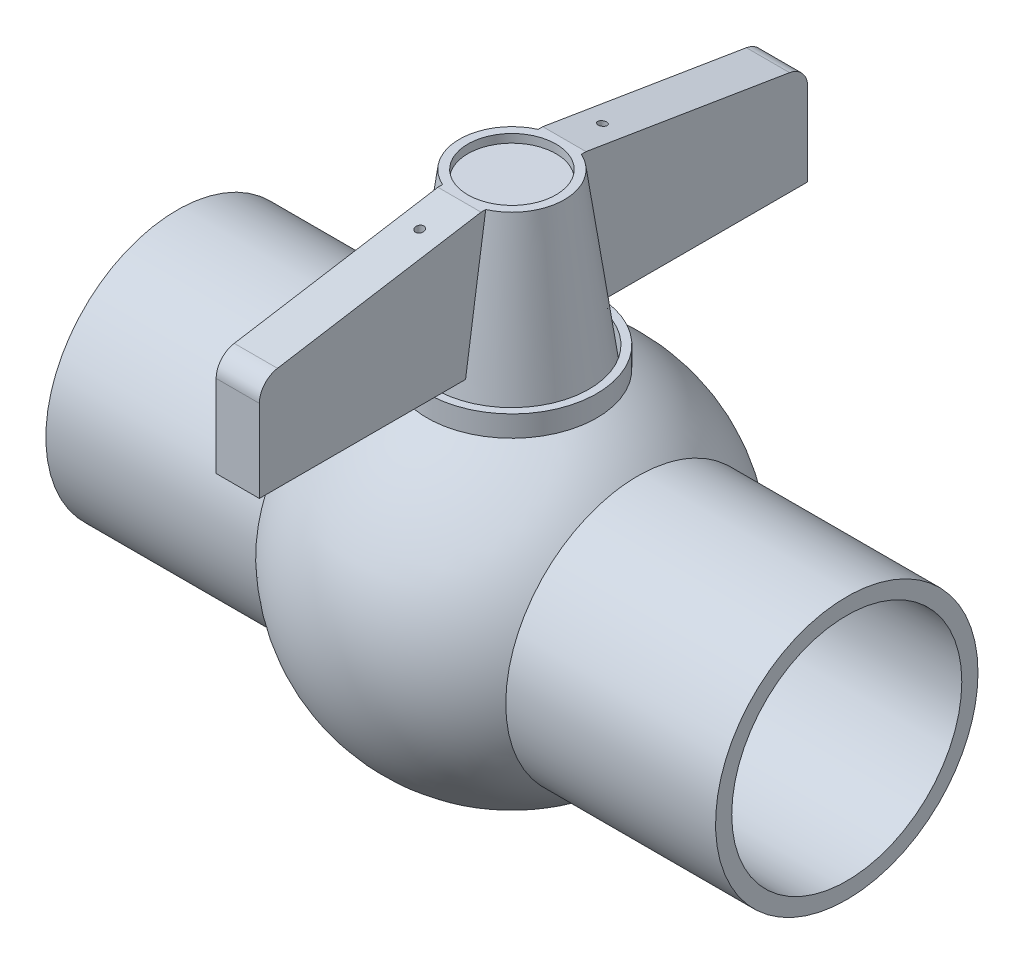
from build123d import *

# Parameters (mm, degrees)
CROQUIS1_R                   = 12.15
CROQUIS1_R_2                 = 10.65
SALIENTE_EXTRUIR1_DEPTH      = 62
SALIENTE_EXTRUIR2_DEPTH      = 2
SALIENTE_EXTRUIR2_DEPTH_BACK = 2
CROQUIS7_R                   = 10.65
CORTAR_EXTRUIR1_DEPTH        = 74.779246403
CROQUIS8_R                   = 0.385
CORTAR_EXTRUIR2_DEPTH        = 12.691251175


with BuildPart() as part:
    # Croquis1 → Saliente-Extruir1 (new body)
    with BuildSketch(Plane(origin=(0, 0, 0), x_dir=(0, 0, -1), z_dir=(1, 0, 0))):
        Circle(CROQUIS1_R)
        Circle(CROQUIS1_R_2, mode=Mode.SUBTRACT)
    extrude(amount=SALIENTE_EXTRUIR1_DEPTH)

    # Croquis2 → Revolución1 (revolve)
    with BuildSketch(Plane(origin=(31, 0, 0), x_dir=(0, 0, -1), z_dir=(1, 0, 0))):
        with BuildLine():
            Line((7.855426501, 16.853610773), (7.855426501, 14.901738017))
            ThreePointArc((7.855426501, 14.901738017), (16.287972929, -3.976783245), (0, -16.712887128))
            Line((0, -16.712887128), (0, 12.683300927))
            Line((0, 12.683300927), (7.141286848, 12.683300927))
            Line((7.141286848, 12.683300927), (7.141286848, 16.853610773))
            Line((7.141286848, 16.853610773), (7.855426501, 16.853610773))
        make_face()
    revolve(axis=Axis((31, -16.712887128, 0), (0, 1, 0)))

    # Croquis7 → Cortar-Extruir1 (cut, through all)
    with BuildSketch(Plane(origin=(62, 0, 0), x_dir=(0, 0, -1), z_dir=(1, 0, 0))):
        Circle(CROQUIS7_R)
    extrude(amount=-CORTAR_EXTRUIR1_DEPTH, mode=Mode.SUBTRACT)


with BuildPart() as body_2:
    # Croquis3 → Revolución2 (revolve)
    with BuildSketch(Plane.ZY.offset(-31), mode=Mode.PRIVATE) as revoluci_n2_sk:
        Polygon((0, 14.901738017), (-7.057889684, 14.901738017), (-4.856346113, 30.90478542), (-4.079330735, 30.90478542), (-4.079330735, 30.127770042), (0, 30.127770042), align=None)
    revolve(revoluci_n2_sk.sketch.rotate(Axis((31, 30.127770042, 0), (0, -1, 0)), 180), axis=Axis((31, 30.127770042, 0), (0, -1, 0)))

    # Croquis4 → Saliente-Extruir2 (add, two sides: drawn at the far end of the back side and taken through both)
    with BuildSketch(Plane.ZY.offset(-31).offset(-SALIENTE_EXTRUIR2_DEPTH_BACK)):
        with BuildLine():
            Line((-4.856346113, 30.90478542), (-23.70625119, 27.812687426))
            ThreePointArc((-23.70625119, 27.812687426), (-24.906887092, 27.13376588), (-25.382502351, 25.839064694))
            Line((-25.382502351, 25.839064694), (-25.382502351, 18.213534245))
            Line((-25.382502351, 18.213534245), (25.382502351, 18.213534245))
            Line((25.382502351, 18.213534245), (25.382502351, 25.839064694))
            ThreePointArc((25.382502351, 25.839064694), (24.906887092, 27.13376588), (23.70625119, 27.812687426))
            Line((23.70625119, 27.812687426), (4.856346113, 30.90478542))
            Line((4.856346113, 30.90478542), (4.079330735, 30.90478542))
            Line((4.079330735, 30.90478542), (4.079330735, 30.127770042))
            Line((4.079330735, 30.127770042), (-4.079330735, 30.127770042))
            Line((-4.079330735, 30.127770042), (-4.079330735, 30.90478542))
            Line((-4.079330735, 30.90478542), (-4.856346113, 30.90478542))
        make_face()
    extrude(amount=SALIENTE_EXTRUIR2_DEPTH + SALIENTE_EXTRUIR2_DEPTH_BACK)

    # Croquis8 → Cortar-Extruir2 (cut)
    with BuildSketch(Plane(origin=(0, 30.90478542, 0), x_dir=(1, 0, 0), z_dir=(0, 1, 0))):
        with Locations(Location((30.913307858, 8.465, 0), (0, 0, 270))):
            Circle(CROQUIS8_R)
        with Locations(Location((30.923288865, -8.464997058, 0), (0, 0, 90))):
            Circle(CROQUIS8_R)
    extrude(amount=-CORTAR_EXTRUIR2_DEPTH, mode=Mode.SUBTRACT)


solid = Compound([part.part, body_2.part])
